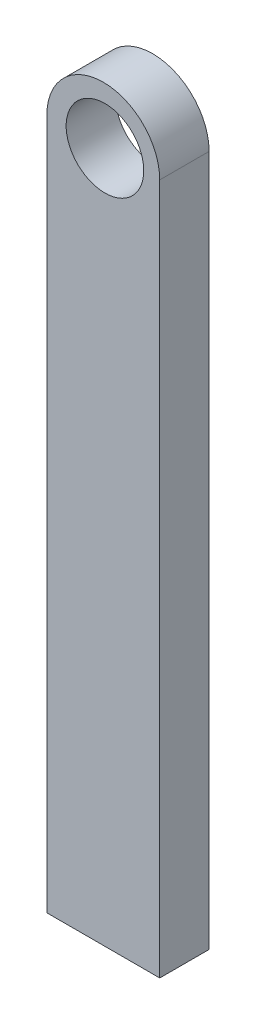
from build123d import *

# Parameters (mm, degrees)
BOSS_EXTRUDE1_DEPTH = 11.1125
SKETCH3_R           = 8.73125
CUT_EXTRUDE1_DEPTH  = 124.928631033


with BuildPart() as part:
    # Sketch1 → Boss-Extrude1 (new body)
    with BuildSketch(Plane.XY):
        with BuildLine():
            Line((-17.21544473, 33.352062725), (-17.21544473, -122.222937275))
            Line((-17.21544473, -122.222937275), (8.18455527, -122.222937275))
            Line((8.18455527, -122.222937275), (8.18455527, 33.352062725))
            ThreePointArc((8.18455527, 33.352062725), (-4.51544473, 46.052062725), (-17.21544473, 33.352062725))
        make_face()
    extrude(amount=BOSS_EXTRUDE1_DEPTH)

    # Sketch3 → Cut-Extrude1 (cut, through all)
    with BuildSketch(Plane.XY.offset(11.1125)):
        with Locations((-4.147405444, 33.357396637)):
            Circle(SKETCH3_R)
    extrude(amount=-CUT_EXTRUDE1_DEPTH, mode=Mode.SUBTRACT)


solid = part.part
